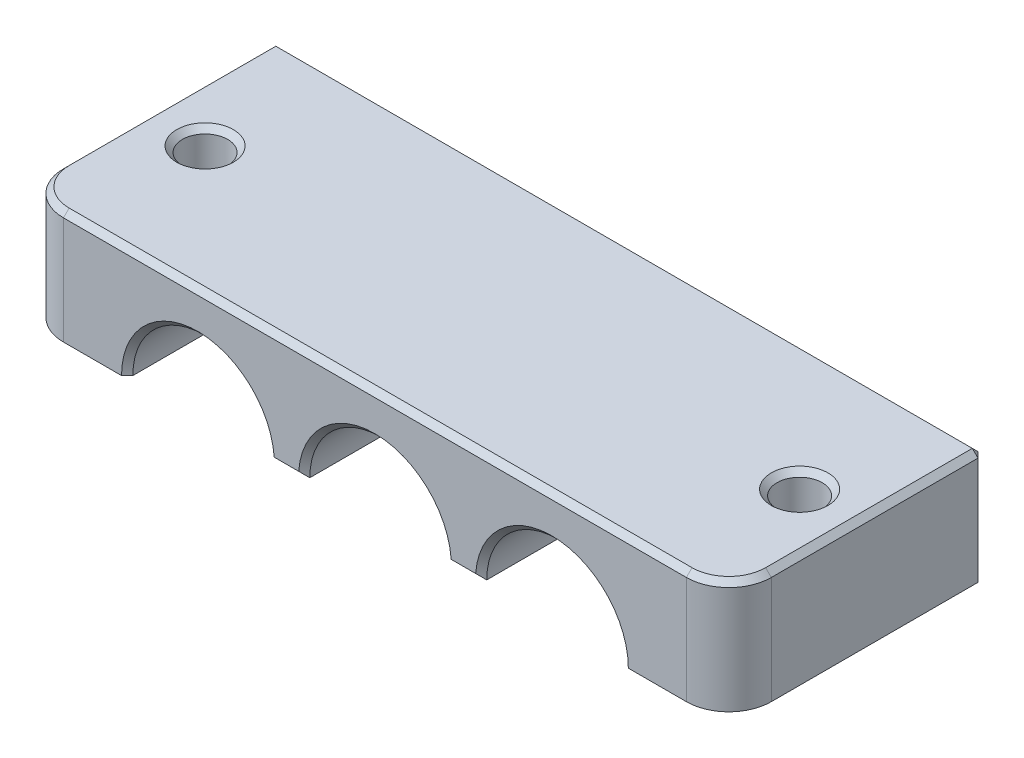
from build123d import *

# Parameters (mm, degrees)
BOSS_EXTRUDE1_DEPTH = 18
SKETCH2_R           = 1.6
CUT_EXTRUDE1_DEPTH  = 32.827660926
FILLET1_R           = 3
CHAMFER1_SIZE       = 0.4


with BuildPart() as part:
    # Sketch1 → Boss-Extrude1 (new body)
    with BuildSketch(Plane.XY):
        with BuildLine():
            Line((-7.5, 0), (-5, 0))
            ThreePointArc((-5, 0), (0, 5), (5, 0))
            Line((5, 0), (7.5, 0))
            ThreePointArc((7.5, 0), (12.5, 5), (17.5, 0))
            Line((17.5, 0), (25, 0))
            Line((25, 0), (25, 8))
            Line((25, 8), (-25, 8))
            Line((-25, 8), (-25, 0))
            Line((-25, 0), (-17.5, 0))
            ThreePointArc((-17.5, 0), (-12.5, 5), (-7.5, 0))
        make_face()
    extrude(amount=BOSS_EXTRUDE1_DEPTH)

    # Sketch2 → Cut-Extrude1 (cut, through all)
    with BuildSketch(Plane(origin=(0, 8, 0), x_dir=(1, 0, 0), z_dir=(0, 1, 0))):
        with Locations(Location((-21, -9, 0), (0, 0, 270))):
            Circle(SKETCH2_R)
        with Locations(Location((21, -9, 0), (0, 0, 270))):
            Circle(SKETCH2_R)
    extrude(amount=-CUT_EXTRUDE1_DEPTH, mode=Mode.SUBTRACT)

    # Fillet1
    fillet1_edges = [part.edges().sort_by_distance(p)[0] for p in [
        (25, 4, 18),
        (-25, 4, 18),
    ]]
    fillet(fillet1_edges, radius=FILLET1_R)

    # Chamfer1
    chamfer1_edges = [part.edges().sort_by_distance(p)[0] for p in [
        (21, 8, 7.4),
        (-21, 8, 7.4),
        (12.5, 5, 0),
        (0, 5, 0),
        (-12.5, 5, 0),
        (0, 8, 0),
        (-25, 4, 0),
        (-25, 8, 7.5),
        (-24.121320344, 8, 17.121320344),
        (0, 8, 18),
        (24.121320344, 8, 17.121320344),
        (25, 8, 7.5),
        (25, 4, 0),
        (12.5, 5, 18),
        (0, 5, 18),
        (-12.5, 5, 18),
        (6.25, 0, 0),
        (-6.25, 0, 0),
        (6.25, 0, 18),
        (-6.25, 0, 18),
    ]]
    chamfer(chamfer1_edges, length=CHAMFER1_SIZE)


solid = part.part
